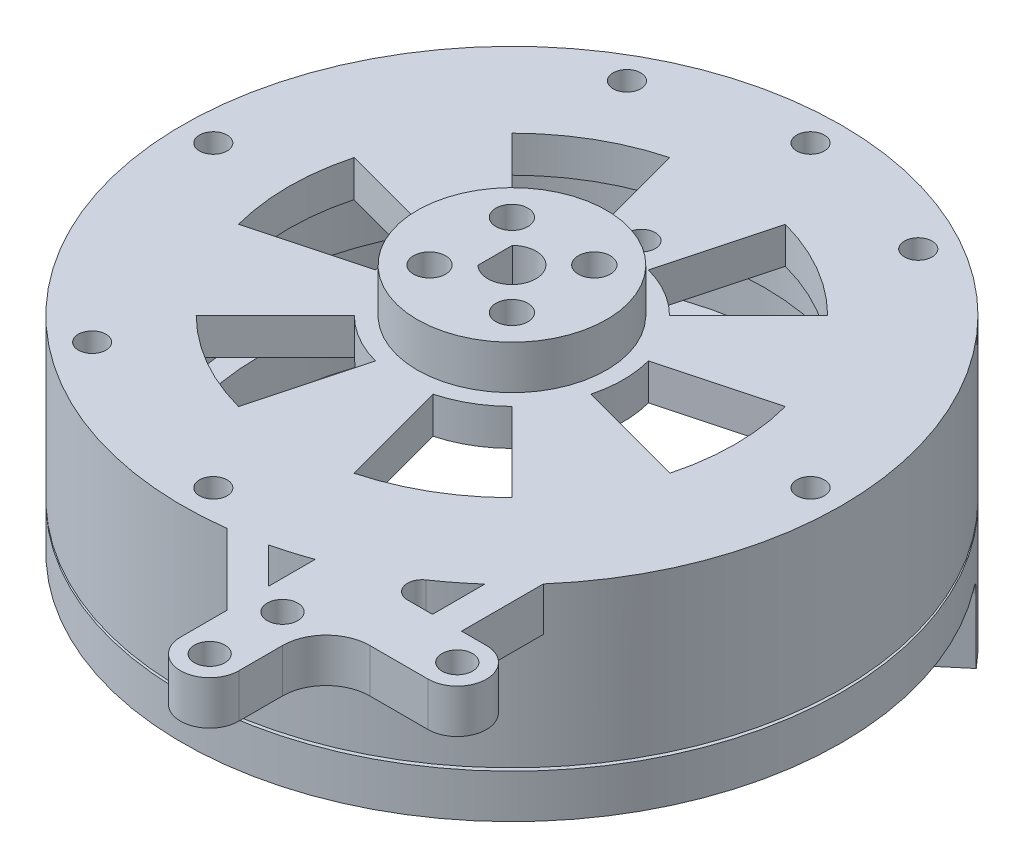
from build123d import *

# Parameters (mm, degrees)
EXTRUDE_START                    = 2
SKETCH_2_R                       = 3.6500000000000004
SKETCH_2_R_2                     = 1.6500000000000004
EXTRUDE_1_DEPTH                  = 2
EXTRUDE_2_DEPTH                  = 4.5
HOLE_WIZARD_1_9_1_9_2_D          = 1.9
EXTRUDE_START_2                  = 0.2
SKETCH_6_R                       = 22.625
SKETCH_6_R_2                     = 17.325
EXTRUDE_3_DEPTH                  = 3
HOLE_WIZARD_2_1_2_1_2_AT_2_COUNT = 2
HOLE_WIZARD_2_1_2_1_2_AT_2_PITCH = 28.991378028648448
HOLE_WIZARD_2_1_2_1_2_AT_3_COUNT = 2
HOLE_WIZARD_2_1_2_1_2_AT_3_PITCH = 41
HOLE_WIZARD_2_1_2_1_2_AT_4_COUNT = 2
HOLE_WIZARD_2_1_2_1_2_AT_4_PITCH = 28.991378028648448
EXTRUDE_START_3                  = -3
SKETCH_9_R                       = 1.0499999999999934
SKETCH_9_R_2                     = 1.0499999999999985
EXTRUDE_4_DEPTH                  = 3
FILLET_1_R                       = 3
FILLET_2_R                       = 1
EXTRUDE_5_DEPTH                  = 3
CUT_EXTRUDE_1_DEPTH              = 2.5
EXTRUDE_START_4                  = 3.2
EXTRUDE_6_DEPTH                  = 5.5
FILLET_3_R                       = 1
CUT_EXTRUDE_START                = 10
SKETCH_13_R                      = 3.6500000000000004
CUT_EXTRUDE_2_DEPTH              = 10
HOLE_WIZARD_2_2_2_2_1_AT_2_COUNT = 2
HOLE_WIZARD_2_2_2_2_1_AT_2_PITCH = 5.65685424949238
HOLE_WIZARD_2_2_2_2_1_AT_3_COUNT = 2
HOLE_WIZARD_2_2_2_2_1_AT_3_PITCH = 8
HOLE_WIZARD_2_2_2_2_1_AT_4_COUNT = 2
HOLE_WIZARD_2_2_2_2_1_AT_4_PITCH = 5.6568542494923815
SKETCH_18_R                      = 6.5
SKETCH_18_R_2                    = 1.0999999999999883
SKETCH_18_R_3                    = 1.0999999999999885
SKETCH_18_R_4                    = 1.0999999999999888
SKETCH_18_R_5                    = 1.099999999999988
EXTRUDE_7_DEPTH                  = 3


with BuildPart() as part:
    # 草图1 → 旋转1 (revolve)
    with BuildSketch(Plane.XY, mode=Mode.PRIVATE) as revolve_1_sk:
        Polygon((18.625, -4.9e-16), (18.625, 3.8999999999999995), (17.325, 3.8999999999999995), (17.325, 8.4), (1.6499999999999986, 8.399999999999999), (1.65, 10.9), (22.625, 10.9), (22.625, 0), align=None)
    revolve(revolve_1_sk.sketch.rotate(Axis((0, 0, 0), (0, 1, 0)), 90), axis=Axis((0, 0, 0), (0, 1, 0)))

    # 草图2 → 凸台-拉伸1 (add)
    with BuildSketch(Plane(origin=(0, 10.9, 0), x_dir=(1, 0, 0), z_dir=(0, 1, 0)).offset(EXTRUDE_START)):
        with Locations(Location((0, 0, 0), (0, 0, 270))):
            Circle(SKETCH_2_R)
        with Locations(Location((0, 0, 0), (0, 0, 90))):
            Circle(SKETCH_2_R_2, mode=Mode.SUBTRACT)
    extrude(amount=-EXTRUDE_1_DEPTH)

    # 草图3 → 凸台-拉伸2 (add)
    with BuildSketch(Plane(origin=(0, 12.9, 0), x_dir=(1, 0, 0), z_dir=(0, 1, 0))):
        with BuildLine():
            Line((-1.1499999999999997, 1.1832159566199236), (-1.1499999999999997, -1.1832159566199236))
            ThreePointArc((-1.1499999999999997, -1.1832159566199236), (-1.6500000000000001, 2e-16), (-1.1499999999999997, 1.1832159566199236))
        make_face()
    extrude(amount=-EXTRUDE_2_DEPTH)

    # Ø1.9 (1.9) 直径孔2 (through all)
    with Locations(Plane(origin=(0, 0, 0), x_dir=(-1, 0, 0), z_dir=(0, -1, 0))):
        with Locations((12.816005618, -16), (-20.5, 0), (0, 20.5), (20.5, 0), (0, -20.5), (-10, 17.895530168), (10, 17.895530168), (0, 8.895530168)):
            Hole(HOLE_WIZARD_1_9_1_9_2_D / 2)

    # 草图9 → 凸台-拉伸4 (add)
    with BuildSketch(Plane(origin=(0, 10.9, 0), x_dir=(1, 0, 0), z_dir=(0, 1, 0)).offset(EXTRUDE_START_3)):
        with BuildLine():
            ThreePointArc((7.75, -30.5), (9.75, -32.5), (11.75, -30.5))
            Line((11.75, -30.5), (11.75, -24.499999999999996))
            Line((11.75, -24.499999999999996), (18.75, -24.499999999999996))
            ThreePointArc((18.75, -24.5), (20.75, -22.5), (18.75, -20.5))
            Line((18.75, -20.499999999999996), (9.572910999272894, -20.5))
            ThreePointArc((9.572910999272901, -20.499999999999996), (8.669705274135236, -20.898010322986053), (7.749999999999996, -21.256249081152582))
            Line((7.75, -21.256249081152582), (7.75, -30.5))
        make_face()
        with Locations(Location((9.75, -30.5, 0), (0, 0, 270))):
            Circle(SKETCH_9_R, mode=Mode.SUBTRACT)
        with Locations(Location((9.75, -25.5, 0), (0, 0, 270))):
            Circle(SKETCH_9_R_2, mode=Mode.SUBTRACT)
        with Locations(Location((18.75, -22.5, 0), (0, 0, 270))):
            Circle(SKETCH_9_R_2, mode=Mode.SUBTRACT)
    extrude(amount=EXTRUDE_4_DEPTH)

    # 圆角1
    fillet_1_edges = [part.edges().sort_by_distance(p)[0] for p in [
        (11.75, 9.4, 24.499999999999996),
    ]]
    fillet(fillet_1_edges, radius=FILLET_1_R)

    # 圆角2
    fillet_2_edges = [part.edges().sort_by_distance(p)[0] for p in [
        (9.572910999272896, 9.4, 20.499999999999996),
    ]]
    fillet(fillet_2_edges, radius=FILLET_2_R)

    # 草图10 → 凸台-拉伸5 (add)
    with BuildSketch(Plane(origin=(0, 10.9, 0), x_dir=(1, 0, 0), z_dir=(0, 1, 0)).offset(EXTRUDE_START_3)):
        with BuildLine():
            Line((7.75, -27.29233810294938), (2.8964892904408646, -22.438827393390266))
            ThreePointArc((2.8964892904408646, -22.438827393390266), (4.096717261259319, -22.251011947354215), (5.285134066870919, -21.99904504507413))
            Line((5.285134066870919, -21.99904504507413), (7.75, -24.4639109782032))
            Line((7.75, -24.4639109782032), (7.75, -27.29233810294938))
        make_face()
        with BuildLine():
            Line((15.043782216417029, -20.5), (15.043782216417029, -16.89897161442124))
            ThreePointArc((15.043782216417029, -16.89897161442124), (16.075524691411957, -15.920682488379839), (17.043782216417032, -14.879519910243964))
            Line((17.043782216417032, -14.879519910243964), (17.043782216417032, -20.5))
            Line((17.043782216417032, -20.5), (15.043782216417029, -20.5))
        make_face()
    extrude(amount=EXTRUDE_5_DEPTH)

    # 草图11 → 切除-拉伸1 (cut)
    with BuildSketch(Plane(origin=(0, 10.9, 0), x_dir=(1, 0, 0), z_dir=(0, 1, 0))):
        with BuildLine():
            Line((-7.389332571111372, 1.979965695034288), (-14.80281328787997, 3.9664018661961387))
            ThreePointArc((-14.80281328787997, 3.9664018661961387), (-15.325, 1.88e-15), (-14.802813287879967, -3.966401866196142))
            Line((-14.802813287879967, -3.966401866196142), (-7.389332571111371, -1.9799656950342899))
            ThreePointArc((-7.389332571111371, -1.9799656950342899), (-7.65, 9.4e-16), (-7.389332571111372, 1.979965695034288))
        make_face()
        with BuildLine():
            Line((-1.9799656950342812, 7.389332571111374), (-3.966401866196125, 14.802813287879975))
            ThreePointArc((-3.966401866196125, 14.802813287879975), (-7.662500000000004, 13.271839312996521), (-10.83641142168385, 10.836411421683831))
            Line((-10.83641142168385, 10.836411421683831), (-5.409366876077093, 5.409366876077084))
            ThreePointArc((-5.409366876077093, 5.409366876077084), (-3.825000000000002, 6.625094338950955), (-1.9799656950342812, 7.389332571111374))
        make_face()
        with BuildLine():
            Line((5.40936687607709, 5.409366876077088), (10.836411421683845, 10.836411421683838))
            ThreePointArc((10.836411421683845, 10.836411421683838), (7.662499999999996, 13.271839312996526), (3.966401866196115, 14.802813287879976))
            Line((3.966401866196115, 14.802813287879976), (1.9799656950342763, 7.3893325711113755))
            ThreePointArc((1.9799656950342763, 7.3893325711113755), (3.824999999999996, 6.625094338950958), (5.40936687607709, 5.409366876077088))
        make_face()
        with BuildLine():
            Line((7.389332571111372, -1.9799656950342872), (14.80281328787997, -3.966401866196137))
            ThreePointArc((14.80281328787997, -3.966401866196137), (15.325, 4.25e-15), (14.802813287879967, 3.966401866196144))
            Line((14.802813287879967, 3.966401866196144), (7.389332571111371, 1.9799656950342908))
            ThreePointArc((7.389332571111371, 1.9799656950342908), (7.65, 2.12e-15), (7.389332571111372, -1.9799656950342872))
        make_face()
        with BuildLine():
            Line((1.9799656950342834, -7.389332571111374), (3.96640186619613, -14.802813287879973))
            ThreePointArc((3.96640186619613, -14.802813287879973), (7.662500000000008, -13.27183931299652), (10.836411421683856, -10.83641142168383))
            Line((10.836411421683856, -10.83641142168383), (5.409366876077096, -5.409366876077082))
            ThreePointArc((5.409366876077096, -5.409366876077082), (3.825000000000004, -6.625094338950954), (1.9799656950342834, -7.389332571111374))
        make_face()
        with BuildLine():
            Line((-5.4093668760770885, -5.40936687607709), (-10.836411421683838, -10.836411421683843))
            ThreePointArc((-10.836411421683838, -10.836411421683843), (-7.66249999999999, -13.271839312996526), (-3.9664018661961076, -14.802813287879978))
            Line((-3.9664018661961076, -14.802813287879978), (-1.9799656950342726, -7.3893325711113755))
            ThreePointArc((-1.9799656950342726, -7.3893325711113755), (-3.8249999999999957, -6.625094338950959), (-5.4093668760770885, -5.40936687607709))
        make_face()
    extrude(amount=-CUT_EXTRUDE_1_DEPTH, mode=Mode.SUBTRACT)

    # 草图13 → 切除-拉伸2 (cut)
    with BuildSketch(Plane(origin=(0, 10.9, 0), x_dir=(1, 0, 0), z_dir=(0, 1, 0)).offset(CUT_EXTRUDE_START)):
        Circle(SKETCH_13_R)
    extrude(amount=-CUT_EXTRUDE_2_DEPTH, mode=Mode.SUBTRACT)

    # 草图17 → Ø2.2 (2.2) 直径孔1 (revolve, cut)
    with BuildSketch(Plane(origin=(-2.8284271247461854, 10.9, 2.828427124746195), x_dir=(0, 0, 1), z_dir=(1, 0, 0))):
        Polygon((0, 0), (-4.8e-15, 19.599999999999998), (1.0999999999999952, 19.599999999999998), (1.099999999999988, -1.42e-15), align=None)
    hole_wizard_2_2_2_2_1 = revolve(axis=Axis((-2.8284271247461854, 17.249999999999993, 2.828427124746195), (0, -1, 0)), mode=Mode.SUBTRACT)

    # Ø2.2 (2.2) 直径孔1 at 2: Ø2.2 (2.2) 直径孔1 ×2
    with Locations(*[(0, 0, -i * HOLE_WIZARD_2_2_2_2_1_AT_2_PITCH) for i in range(1, HOLE_WIZARD_2_2_2_2_1_AT_2_COUNT)]):
        add(hole_wizard_2_2_2_2_1, mode=Mode.SUBTRACT)

    # Ø2.2 (2.2) 直径孔1 at 3: Ø2.2 (2.2) 直径孔1 ×2
    with Locations(*[Vector(0.7071067811865464, 0, -0.7071067811865488) * (i * HOLE_WIZARD_2_2_2_2_1_AT_3_PITCH) for i in range(1, HOLE_WIZARD_2_2_2_2_1_AT_3_COUNT)]):
        add(hole_wizard_2_2_2_2_1, mode=Mode.SUBTRACT)

    # Ø2.2 (2.2) 直径孔1 at 4: Ø2.2 (2.2) 直径孔1 ×2
    with Locations(*[(i * HOLE_WIZARD_2_2_2_2_1_AT_4_PITCH, 0, 0) for i in range(1, HOLE_WIZARD_2_2_2_2_1_AT_4_COUNT)]):
        add(hole_wizard_2_2_2_2_1, mode=Mode.SUBTRACT)


with BuildPart() as body_2:
    # 草图6 → 凸台-拉伸3 (new body)
    with BuildSketch(Plane.XZ.offset(EXTRUDE_START_2)):
        with Locations(Location((0, 0, 0), (0, 0, 270))):
            Circle(SKETCH_6_R)
        with Locations(Location((0, 0, 0), (0, 0, 270))):
            Circle(SKETCH_6_R_2, mode=Mode.SUBTRACT)
    extrude(amount=EXTRUDE_3_DEPTH)

    # 草图8 → Ø2.1 (2.1) 直径孔2 (revolve, cut)
    with BuildSketch(Plane(origin=(-20.5, -3.2, 0), x_dir=(0, 0, -1), z_dir=(1, 0, 0))):
        Polygon((0, 0), (-7.4e-16, 3.0010000000000003), (1.0499999999999994, 3.0010000000000003), (1.0499999999999987, 1e-17), align=None)
    hole_wizard_2_1_2_1_2 = revolve(axis=Axis((-20.5, -9.54999999999999, 0), (0, 1, 0)), mode=Mode.SUBTRACT)

    # Ø2.1 (2.1) 直径孔2 at 2: Ø2.1 (2.1) 直径孔2 ×2
    with Locations(*[Vector(0.7071067811865476, 0, -0.7071067811865476) * (i * HOLE_WIZARD_2_1_2_1_2_AT_2_PITCH) for i in range(1, HOLE_WIZARD_2_1_2_1_2_AT_2_COUNT)]):
        add(hole_wizard_2_1_2_1_2, mode=Mode.SUBTRACT)

    # Ø2.1 (2.1) 直径孔2 at 3: Ø2.1 (2.1) 直径孔2 ×2
    with Locations(*[(i * HOLE_WIZARD_2_1_2_1_2_AT_3_PITCH, 0, 0) for i in range(1, HOLE_WIZARD_2_1_2_1_2_AT_3_COUNT)]):
        add(hole_wizard_2_1_2_1_2, mode=Mode.SUBTRACT)

    # Ø2.1 (2.1) 直径孔2 at 4: Ø2.1 (2.1) 直径孔2 ×2
    with Locations(*[Vector(0.7071067811865476, 0, 0.7071067811865476) * (i * HOLE_WIZARD_2_1_2_1_2_AT_4_PITCH) for i in range(1, HOLE_WIZARD_2_1_2_1_2_AT_4_COUNT)]):
        add(hole_wizard_2_1_2_1_2, mode=Mode.SUBTRACT)

    # 草图12 → 凸台-拉伸6 (add)
    with BuildSketch(Plane.XZ.offset(EXTRUDE_START_4)):
        with BuildLine():
            Line((11.971919230411768, -14.26757775309099), (14.543069669157921, -17.331755525566905))
            ThreePointArc((14.543069669157921, -17.331755525566905), (15.998290924345609, -15.998290924345666), (17.331755525566855, -14.543069669157981))
            Line((17.331755525566855, -14.543069669157981), (14.267577753090945, -11.97191923041182))
            ThreePointArc((14.267577753090945, -11.97191923041182), (13.169863799599424, -13.16986379959947), (11.971919230411768, -14.26757775309099))
        make_face()
    extrude(amount=EXTRUDE_6_DEPTH)

    # 圆角3
    fillet_3_edges = [body_2.edges().sort_by_distance(p)[0] for p in [
        (15.799666639328901, -3.2, -13.2574944497849),
        (13.257494449784843, -3.2, -15.799666639328947),
    ]]
    fillet(fillet_3_edges, radius=FILLET_3_R)


with BuildPart() as body_3:
    # 草图18 → 凸台-拉伸7 (new body)
    with BuildSketch(Plane(origin=(0, 10.9, 0), x_dir=(1, 0, 0), z_dir=(0, 1, 0))):
        with Locations(Location((0, 0, 0), (0, 0, 270))):
            Circle(SKETCH_18_R)
        with Locations(Location((2.8284271247461956, -2.8284271247461845, 0), (0, 0, 270))):
            Circle(SKETCH_18_R_2, mode=Mode.SUBTRACT)
        with Locations(Location((-2.8284271247461854, -2.828427124746195, 0), (0, 0, 270))):
            Circle(SKETCH_18_R_3, mode=Mode.SUBTRACT)
        with Locations(Location((2.828427124746185, 2.8284271247461956, 0), (0, 0, 270))):
            Circle(SKETCH_18_R_4, mode=Mode.SUBTRACT)
        with Locations(Location((-2.828427124746195, 2.828427124746185, 0), (0, 0, 270))):
            Circle(SKETCH_18_R_5, mode=Mode.SUBTRACT)
        with BuildLine():
            Line((-1.1499999999999997, 1.1832159566199236), (-1.1499999999999997, -1.1832159566199236))
            ThreePointArc((-1.1499999999999997, -1.1832159566199236), (1.6500000000000001, 0), (-1.1499999999999997, 1.1832159566199236))
        make_face(mode=Mode.SUBTRACT)
    extrude(amount=EXTRUDE_7_DEPTH)


solid = Compound([part.part, body_2.part, body_3.part])
